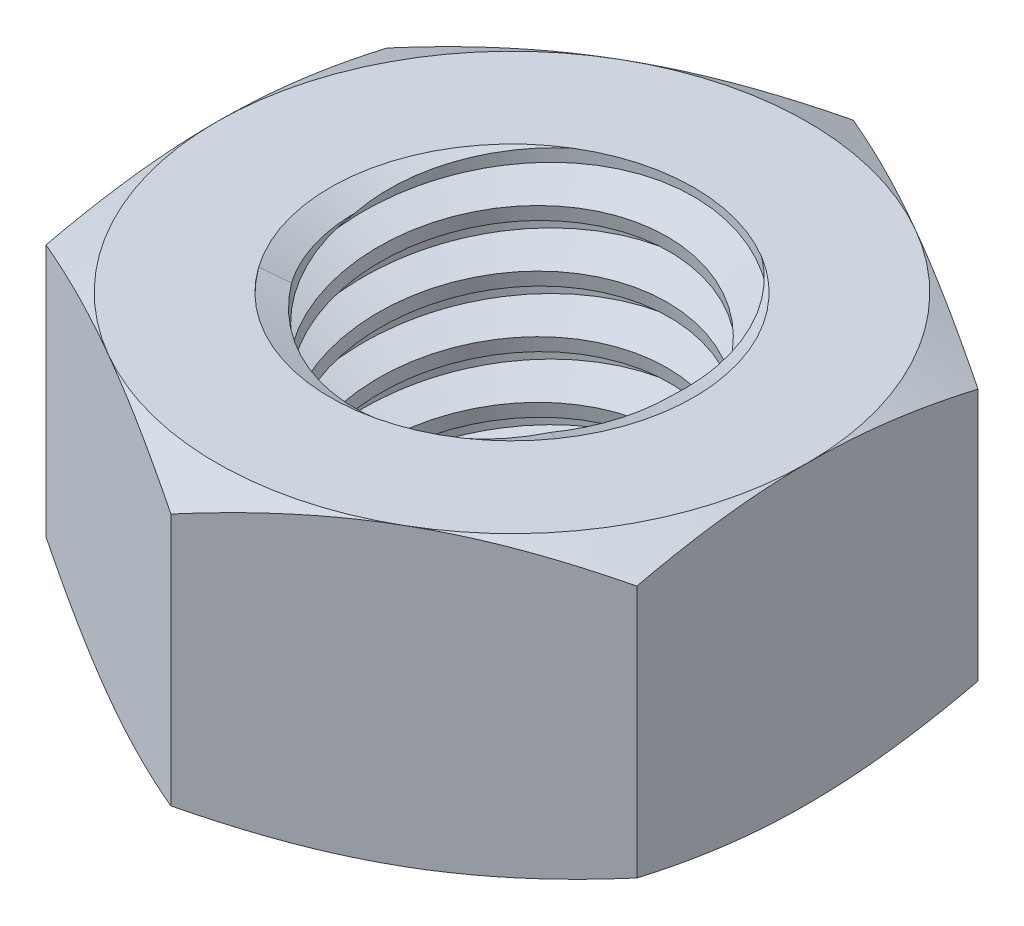
from build123d import *

# Parameters (mm, degrees)
EXTRUDE1_DEPTH      = 3.25
SKETCH2_W           = 4
SKETCH2_H           = 6.5
LPATTERN1_COUNT     = 5
LPATTERN1_PITCH     = 1.25
LPATTERN1_COL_COUNT = 2
LPATTERN1_COL_PITCH = 1.25


with BuildPart() as part:
    # Sketch1 → Extrude1 (new, symmetric)
    with BuildSketch(Plane(origin=(0, 0, 0), x_dir=(1, 0, 0), z_dir=(0, 1, 0))):
        Polygon((0, 7.505553499), (-6.5, 3.75277675), (-6.5, -3.75277675), (0, -7.505553499), (6.5, -3.75277675), (6.5, 3.75277675), align=None)
    extrude(amount=EXTRUDE1_DEPTH, both=True)

    # Sketch4 → Cut-Revolve2 (revolve, cut)
    with BuildSketch(Plane(origin=(0, 0, 0), x_dir=(0, 0, -1), z_dir=(1, 0, 0)), mode=Mode.PRIVATE) as cut_revolve2_sk:
        Polygon((0, 3.25), (4, 3.25), (3.415953356, 2.977654577), (3.415953356, -2.977654577), (4, -3.25), (0, -3.25), align=None)
    revolve(cut_revolve2_sk.sketch.rotate(Axis((0, 3.25, 0), (0, 1, 0)), 55.056269787), axis=Axis((0, 3.25, 0), (0, 1, 0)), mode=Mode.SUBTRACT)


with BuildPart() as body_2:
    # Sketch2 → Revolve1 (revolve)
    with BuildSketch(Plane(origin=(0, 0, 0), x_dir=(0, 0, -1), z_dir=(1, 0, 0))):
        with Locations((2, 0)):
            Rectangle(SKETCH2_W, SKETCH2_H)
    revolve(axis=Axis((0, -7.25, 0), (0, 1, 0)))

    # Sketch3 → Cut-Revolve1 (revolve, cut)
    with BuildSketch(Plane(origin=(0, 0, 0), x_dir=(0, 0, -1), z_dir=(1, 0, 0)), mode=Mode.PRIVATE) as cut_revolve1_sk:
        Polygon((4.024121388, 3.09562312), (4.1929711, 2.014984958), (3.464196131, 2.296478487), (3.415953356, 2.605232247), align=None)
    cut_revolve1 = revolve(cut_revolve1_sk.sketch.rotate(Axis((0, 3.25, 0.208852549), (0, -0.9880120337511015, -0.15437688027360988)), 180), axis=Axis((0, 3.25, 0.208852549), (0, -0.9880120337511015, -0.15437688027360988)), mode=Mode.SUBTRACT)

    # LPattern1: Cut-Revolve1 ×5
    with Locations(*[(0, -i * LPATTERN1_PITCH, 0) for i in range(1, LPATTERN1_COUNT)]):
        add(cut_revolve1, mode=Mode.SUBTRACT)

    # LPattern1 col: Cut-Revolve1 ×2
    with Locations(*[(0, i * LPATTERN1_COL_PITCH, 0) for i in range(1, LPATTERN1_COL_COUNT)]):
        add(cut_revolve1, mode=Mode.SUBTRACT)


with BuildPart() as part_1:
    add(part.part)

    # Combine1: cut body 2
    add(body_2.part, mode=Mode.SUBTRACT)

    # Sketch5 → Cut-Revolve3 (revolve, cut)
    with BuildSketch(Plane(origin=(0, 0, 0), x_dir=(0, 0, -1), z_dir=(1, 0, 0)), mode=Mode.PRIVATE) as cut_revolve3_sk:
        Polygon((0, -3.25), (6.5, -3.25), (7.505553499, -2.781102703), (7.505553499, 2.781102703), (6.5, 3.25), (0, 3.25), (0, 4.52), (8.775553499, 4.52), (8.775553499, -4.52), (0, -4.52), align=None)
    revolve(cut_revolve3_sk.sketch.rotate(Axis((0, -3.25, 0), (0, 1, 0)), 55.056269787), axis=Axis((0, -3.25, 0), (0, 1, 0)), mode=Mode.SUBTRACT)


solid = part_1.part
